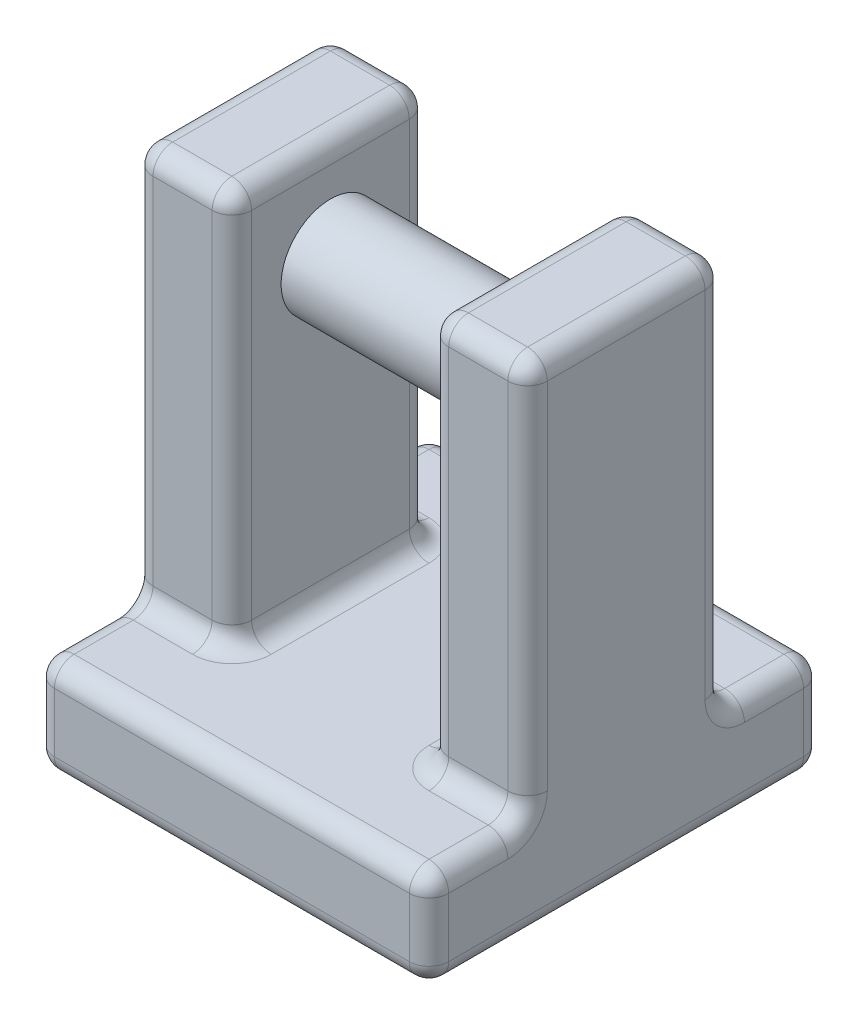
from build123d import *

# Parameters (mm, degrees)
CROQUIS1_W              = 20
CROQUIS1_H              = 20
SALIENTE_EXTRUIR1_DEPTH = 5
CROQUIS2_W              = 5
CROQUIS2_H              = 10
SALIENTE_EXTRUIR2_DEPTH = 20
SALIENTE_EXTRUIR3_REACH = 32.822
CROQUIS3_R              = 2.5
REDONDEO4_R             = 1


with BuildPart() as part:
    # Croquis1 → Saliente-Extruir1 (new body)
    with BuildSketch(Plane(origin=(0, 0, 0), x_dir=(1, 0, 0), z_dir=(0, 1, 0))):
        Rectangle(CROQUIS1_W, CROQUIS1_H)
    extrude(amount=SALIENTE_EXTRUIR1_DEPTH)

    # Croquis2 → Saliente-Extruir2 (add)
    with BuildSketch(Plane(origin=(0, 5, 0), x_dir=(1, 0, 0), z_dir=(0, 1, 0))):
        with Locations((-7.5, 0)):
            Rectangle(CROQUIS2_W, CROQUIS2_H)
        with Locations((7.5, 0)):
            Rectangle(CROQUIS2_W, CROQUIS2_H)
    extrude(amount=SALIENTE_EXTRUIR2_DEPTH)

    # Croquis3 → Saliente-Extruir3 (add, up to next)
    with BuildSketch(Plane.ZY.offset(-5), mode=Mode.PRIVATE) as saliente_extruir3_sk1:
        with Locations(Location((0, 20, 0), (0, 0, 180))):
            Circle(CROQUIS3_R)
    saliente_extruir3_tool1 = extrude(saliente_extruir3_sk1.sketch, amount=SALIENTE_EXTRUIR3_REACH, mode=Mode.PRIVATE) - part.part
    add(saliente_extruir3_tool1.solids().sort_by_distance((5, 20, 0))[0])

    # Redondeo4
    redondeo4_edges = [part.edges().sort_by_distance(p)[0] for p in [
        (10, 5, 7.5),
        (0, 5, -10),
        (-10, 5, 7.5),
        (-10, 15, -5),
        (-7.5, 5, 5),
        (-10, 15, 5),
        (-5, 5, 0),
        (-5, 15, 5),
        (-7.5, 5, -5),
        (-5, 15, -5),
        (-10, 25, 0),
        (-7.5, 25, 5),
        (-5, 25, 0),
        (-7.5, 25, -5),
        (10, 5, -7.5),
        (5, 5, 0),
        (5, 15, -5),
        (7.5, 5, 5),
        (5, 15, 5),
        (10, 15, 5),
        (7.5, 5, -5),
        (10, 15, -5),
        (5, 25, 0),
        (7.5, 25, 5),
        (10, 25, 0),
        (7.5, 25, -5),
        (-10, 5, -7.5),
        (0, 0, -10),
        (10, 0, 0),
        (0, 0, 10),
        (-10, 0, 0),
        (0, 5, 10),
        (-10, 2.5, -10),
        (10, 2.5, -10),
        (10, 2.5, 10),
        (-10, 2.5, 10),
    ]]
    fillet(redondeo4_edges, radius=REDONDEO4_R)


solid = part.part
